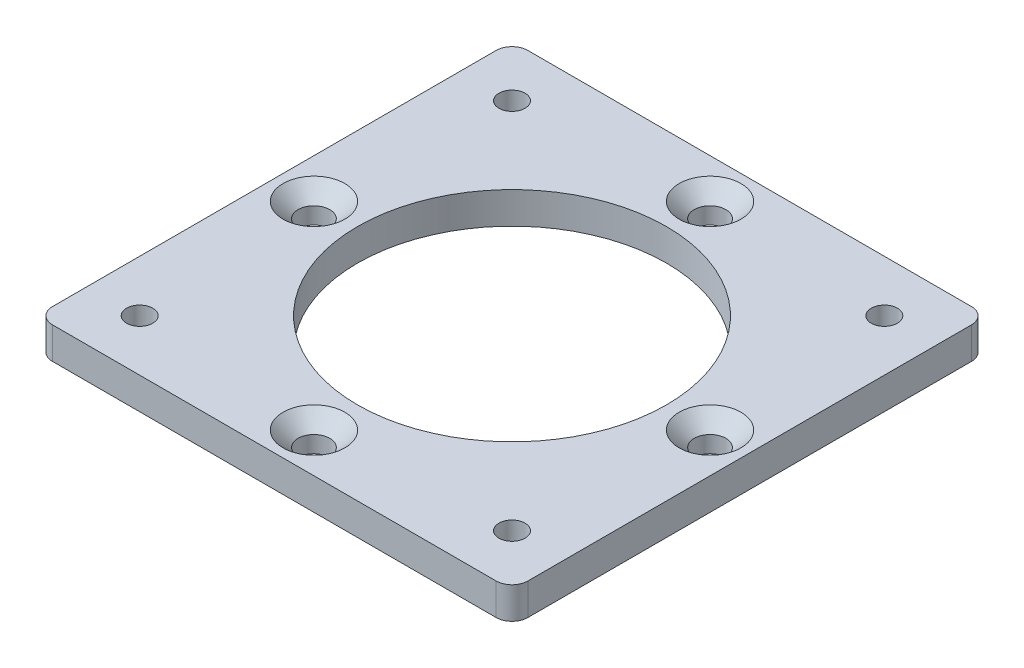
from build123d import *

# Parameters (mm, degrees)
SKETCH_1_W      = 60
SKETCH_1_H      = 60
SKETCH_1_R      = 1.65
SKETCH_1_R_2    = 19.5
SKETCH_1_R_3    = 2
EXTRUDE_1_DEPTH = 4
FILLET_1_R      = 2
CHAMFER_1_SIZE  = 1.9


with BuildPart() as part:
    # Эскиз1 → Бобышка-Вытянуть1 (new body)
    with BuildSketch(Plane(origin=(0, 0, 0), x_dir=(1, 0, 0), z_dir=(0, 1, 0))):
        with Locations((-9.094903125, 3.781032797)):
            Rectangle(SKETCH_1_W, SKETCH_1_H)
        with Locations(Location((-32.594903125, 27.281032797, 0), (0, 0, 270))):
            Circle(SKETCH_1_R, mode=Mode.SUBTRACT)
        with Locations(Location((14.405096875, 27.281032797, 0), (0, 0, 270))):
            Circle(SKETCH_1_R, mode=Mode.SUBTRACT)
        with Locations(Location((-32.594903125, -19.718967203, 0), (0, 0, 270))):
            Circle(SKETCH_1_R, mode=Mode.SUBTRACT)
        with Locations(Location((14.405096875, -19.718967203, 0), (0, 0, 270))):
            Circle(SKETCH_1_R, mode=Mode.SUBTRACT)
        with Locations(Location((-9.094903125, 3.781032797, 0), (0, 0, 270))):
            Circle(SKETCH_1_R_2, mode=Mode.SUBTRACT)
        with Locations(Location((-34.094903125, 3.781032797, 0), (0, 0, 270))):
            Circle(SKETCH_1_R_3, mode=Mode.SUBTRACT)
        with Locations(Location((15.905096875, 3.781032797, 0), (0, 0, 270))):
            Circle(SKETCH_1_R_3, mode=Mode.SUBTRACT)
        with Locations(Location((-9.094903125, 28.781032797, 0), (0, 0, 270))):
            Circle(SKETCH_1_R_3, mode=Mode.SUBTRACT)
        with Locations(Location((-9.094903125, -21.218967203, 0), (0, 0, 270))):
            Circle(SKETCH_1_R_3, mode=Mode.SUBTRACT)
    extrude(amount=EXTRUDE_1_DEPTH)

    # Скругление1
    fillet_1_edges = [part.edges().sort_by_distance(p)[0] for p in [
        (-39.094903125, 2, -33.781032797),
        (20.905096875, 2, -33.781032797),
        (20.905096875, 2, 26.218967203),
        (-39.094903125, 2, 26.218967203),
    ]]
    fillet(fillet_1_edges, radius=FILLET_1_R)

    # Фаска1
    chamfer_1_edges = [part.edges().sort_by_distance(p)[0] for p in [
        (-34.094903125, 4, -5.781032797),
        (15.905096875, 4, -5.781032797),
        (-9.094903125, 4, -30.781032797),
        (-9.094903125, 4, 19.218967203),
    ]]
    chamfer(chamfer_1_edges, length=CHAMFER_1_SIZE)


solid = part.part
